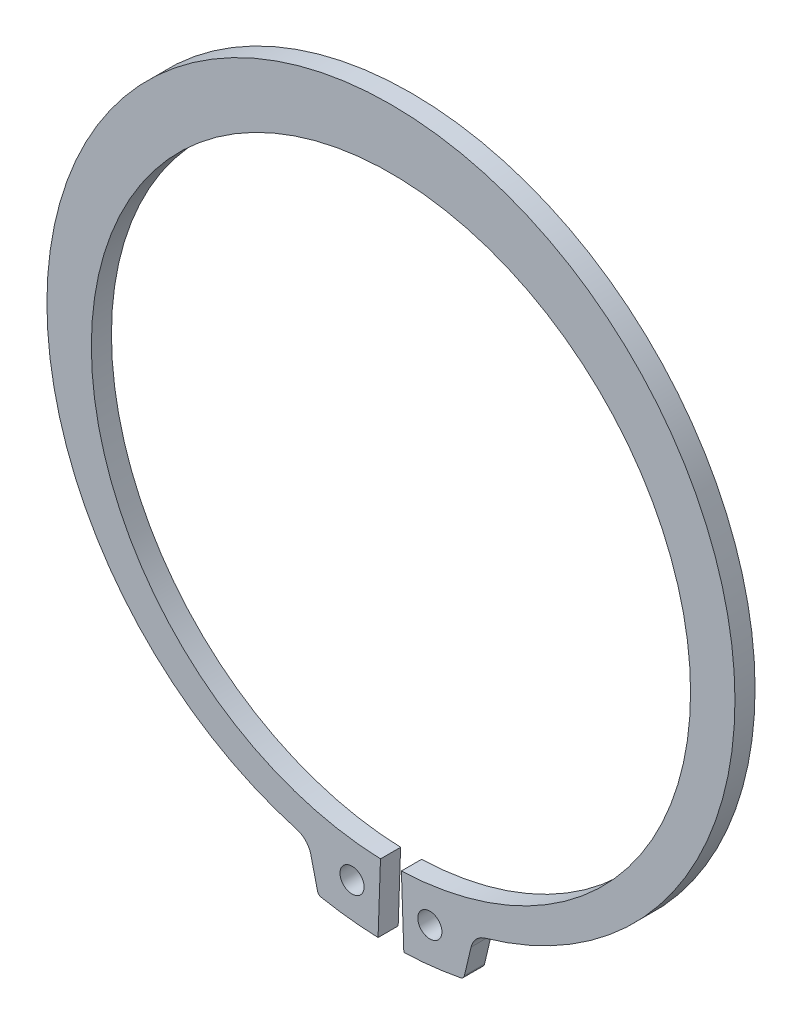
from build123d import *

# Parameters (mm, degrees)
SKETCH4_R           = 1.5
BOSS_EXTRUDE1_DEPTH = 1.25
FILLET1_R           = 2.506040444
FILLET2_R           = 0.626510111


with BuildPart() as part:
    # Sketch4 → Boss-Extrude1 (new, symmetric)
    with BuildSketch(Plane.XY):
        with BuildLine():
            Line((-9.04186024, -44.978115122), (-10.304675826, -39.632261557))
            ThreePointArc((-10.304675826, -39.632261557), (-42.454934805, 7.069629236), (0, 44.65))
            Line((0, 44.65), (0, 37.25))
            ThreePointArc((0, 37.25), (-37.244326645, 0.65010214), (-1.300006252, -37.227308306))
            Line((-1.300006252, -37.227308306), (-1.601117281, -45.85))
            ThreePointArc((-1.601117281, -45.85), (-5.339315353, -45.566191284), (-9.04186024, -44.978115122))
        make_face()
        with Locations((-4.837251338, -41.281532406)):
            Circle(SKETCH4_R, mode=Mode.SUBTRACT)
    extrude(amount=BOSS_EXTRUDE1_DEPTH, both=True)

    # Fillet1
    fillet1_edges = [part.edges().sort_by_distance(p)[0] for p in [
        (-10.304675826, -39.632261557, 0),
    ]]
    fillet(fillet1_edges, radius=FILLET1_R)

    # Fillet2
    fillet2_edges = [part.edges().sort_by_distance(p)[0] for p in [
        (-9.04186024, -44.978115122, 0),
    ]]
    fillet(fillet2_edges, radius=FILLET2_R)

    # Mirror1: part across plane


with BuildPart() as part_1:
    add(part.part)
    add(part.part.mirror(Plane(origin=(0, 44.65, 1.25), x_dir=(0, 0, 1), z_dir=(-1, 0, 0))))


solid = part_1.part
